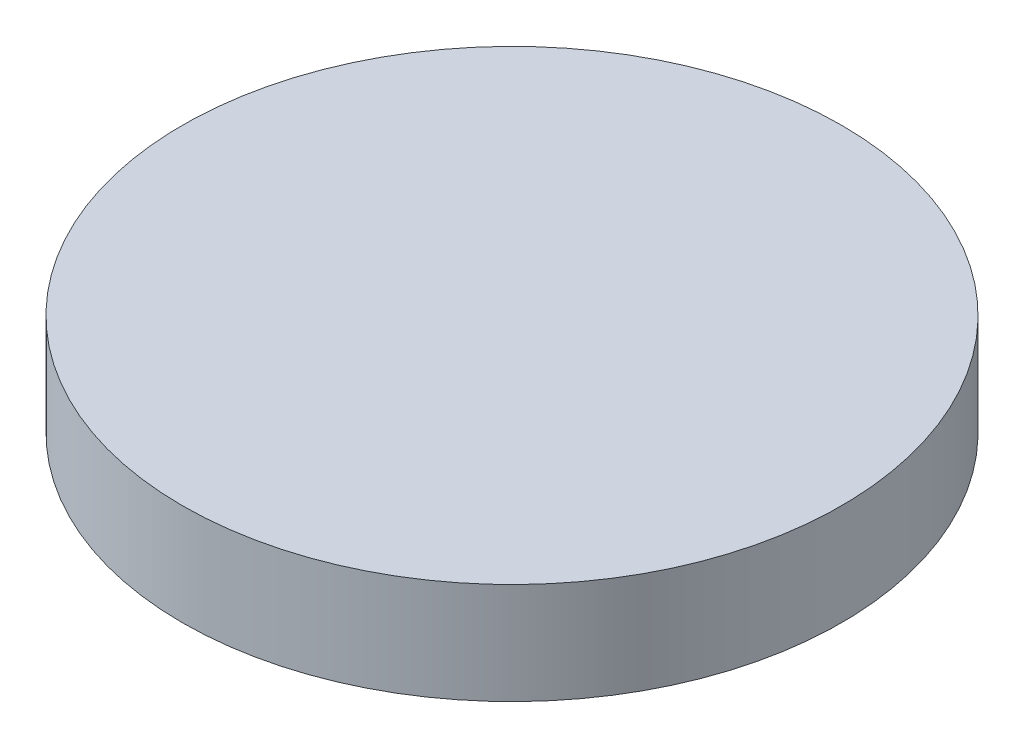
from build123d import *

# Parameters (mm, degrees)
SKETCH1_R           = 20.64
BOSS_EXTRUDE1_DEPTH = 6.35


with BuildPart() as part:
    # Sketch1 → Boss-Extrude1 (new body)
    with BuildSketch(Plane(origin=(0, 0, 0), x_dir=(1, 0, 0), z_dir=(0, 1, 0))):
        with Locations(Location((0, 0, 0), (0, 0, 270))):
            Circle(SKETCH1_R)
    extrude(amount=BOSS_EXTRUDE1_DEPTH)


solid = part.part
